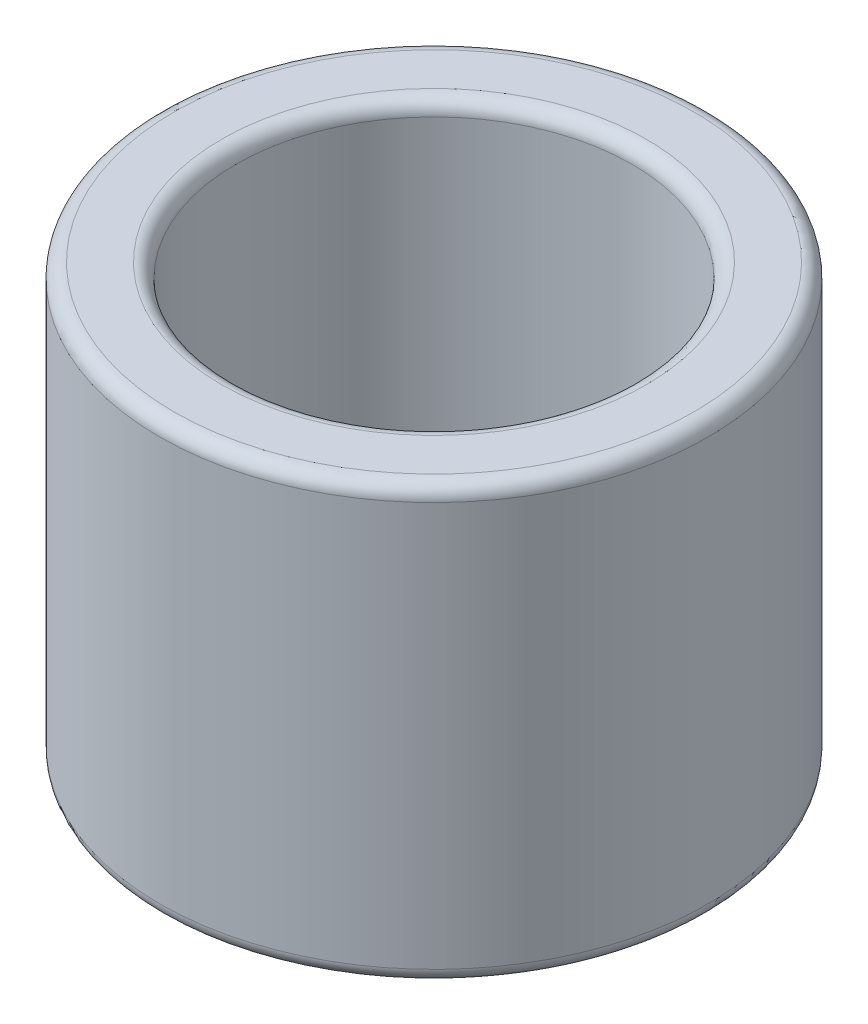
from build123d import *

# Parameters (mm, degrees)
SKETCH1_R           = 48.26
BOSS_EXTRUDE1_DEPTH = 38.1
SKETCH3_R           = 34.844372605
CUT_EXTRUDE2_DEPTH  = 50.8
FILLET1_R           = 2.54


with BuildPart() as part:
    # Sketch1 → Boss-Extrude1 (new, symmetric)
    with BuildSketch(Plane(origin=(0, 0, 0), x_dir=(1, 0, 0), z_dir=(0, 1, 0))):
        with Locations(Location((0, 0, 0), (0, 0, 90))):
            Circle(SKETCH1_R)
    extrude(amount=BOSS_EXTRUDE1_DEPTH, both=True)

    # Sketch3 → Cut-Extrude2 (cut)
    with BuildSketch(Plane(origin=(0, 38.1, 0), x_dir=(1, 0, 0), z_dir=(0, 1, 0))):
        with Locations(Location((0, 0, 0), (0, 0, 270))):
            Circle(SKETCH3_R)
    extrude(amount=-CUT_EXTRUDE2_DEPTH, mode=Mode.SUBTRACT)

    # Fillet1
    fillet1_edges = [part.edges().sort_by_distance(p)[0] for p in [
        (0, -38.1, 48.26),
        (0, 38.1, 48.26),
        (0, 38.1, -34.844372605),
    ]]
    fillet(fillet1_edges, radius=FILLET1_R)


solid = part.part
